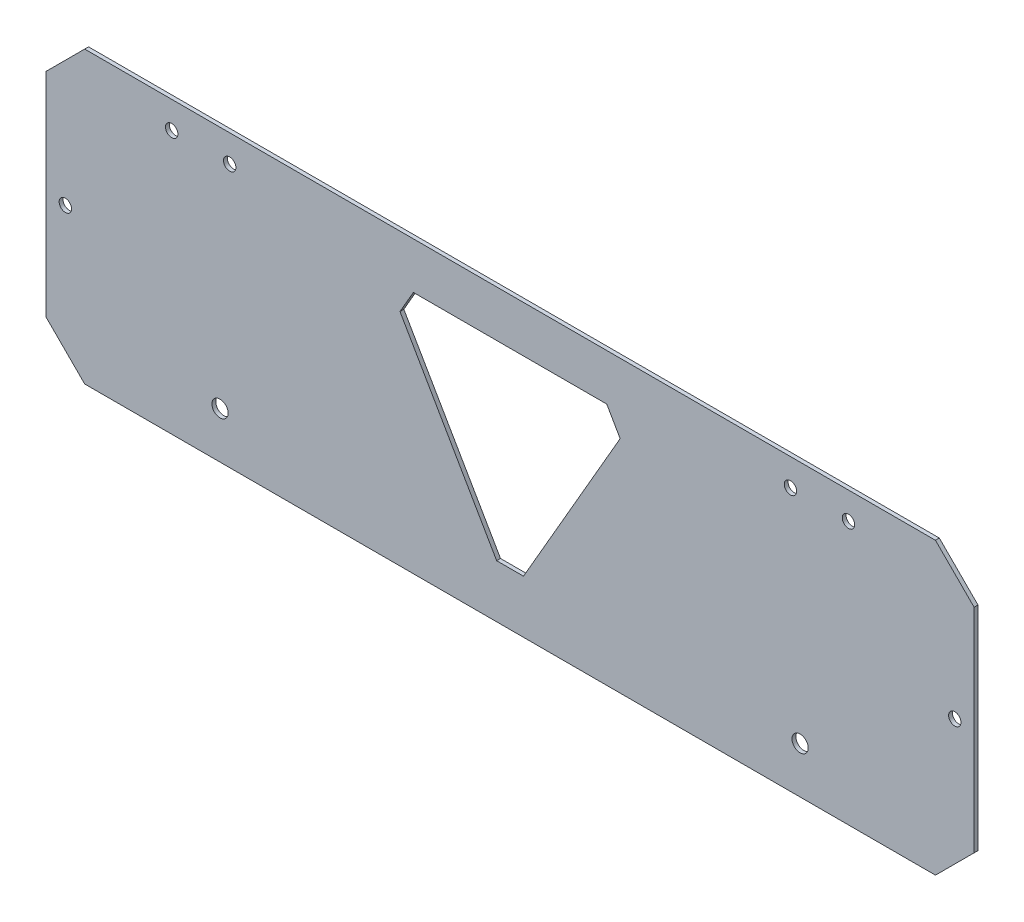
from build123d import *

# Parameters (mm, degrees)
SKETCH_1_W          = 240
SKETCH_1_H          = 75
EXTRUDE_1_DEPTH     = 1
CHAMFER_1_SIZE      = 10
CUT_EXTRUDE_2_DEPTH = 10
SKETCH_4_R          = 2.1
SKETCH_4_R_2        = 1.6
CUT_EXTRUDE_3_DEPTH = 10
EXTRUDE_2_DEPTH     = 1


with BuildPart() as part:
    # 草图1 → 凸台-拉伸1 (new body)
    with BuildSketch(Plane.XY):
        with Locations((120, 37.5)):
            Rectangle(SKETCH_1_W, SKETCH_1_H)
    extrude(amount=EXTRUDE_1_DEPTH)

    # 倒角1
    chamfer_1_edges = [part.edges().sort_by_distance(p)[0] for p in [
        (0, 75, 0.5),
        (240, 75, 0.5),
        (240, 0, 0.5),
        (0, 0, 0.5),
    ]]
    chamfer(chamfer_1_edges, length=CHAMFER_1_SIZE)

    # 草图3 → 切除-拉伸2 (cut)
    with BuildSketch(Plane(origin=(0, 0, 0), x_dir=(-1, 0, 0), z_dir=(0, 0, -1))):
        Polygon((-148.469655115, 56.990381057), (-135, 33.660254038), (-130, 42.320508076), (-110, 42.320508076), (-105, 33.660254038), (-91.530344885, 56.990381057), (-95, 63), (-145, 63), align=None)
        Polygon((-130, 7.679491924), (-110, 7.679491924), (-100, 25), (-110, 42.320508076), (-130, 42.320508076), (-140, 25), align=None)
    extrude(amount=-CUT_EXTRUDE_2_DEPTH, mode=Mode.SUBTRACT)

    # 草图4 → 切除-拉伸3 (cut)
    with BuildSketch(Plane(origin=(0, 0, 0), x_dir=(-1, 0, 0), z_dir=(0, 0, -1))):
        with Locations((-195, 12)):
            Circle(SKETCH_4_R)
        with Locations((-45, 12)):
            Circle(SKETCH_4_R)
        with Locations((-207.5, 68)):
            Circle(SKETCH_4_R_2)
        with Locations((-192.5, 68)):
            Circle(SKETCH_4_R_2)
        with Locations((-47.5, 68)):
            Circle(SKETCH_4_R_2)
        with Locations((-32.5, 68)):
            Circle(SKETCH_4_R_2)
        with Locations((-235, 37.5)):
            Circle(SKETCH_4_R_2)
        with Locations((-5, 37.5)):
            Circle(SKETCH_4_R_2)
    extrude(amount=-CUT_EXTRUDE_3_DEPTH, mode=Mode.SUBTRACT)

    # 草图5 → 凸台-拉伸2 (add)
    with BuildSketch(Plane.XY.offset(1)):
        Polygon((135, 33.660254038), (123.469655115, 13.689110868), (116.530344885, 13.689110868), (105, 33.660254038), (100, 25), (110, 7.679491924), (130, 7.679491924), (140, 25), align=None)
    extrude(amount=-EXTRUDE_2_DEPTH)


solid = part.part
